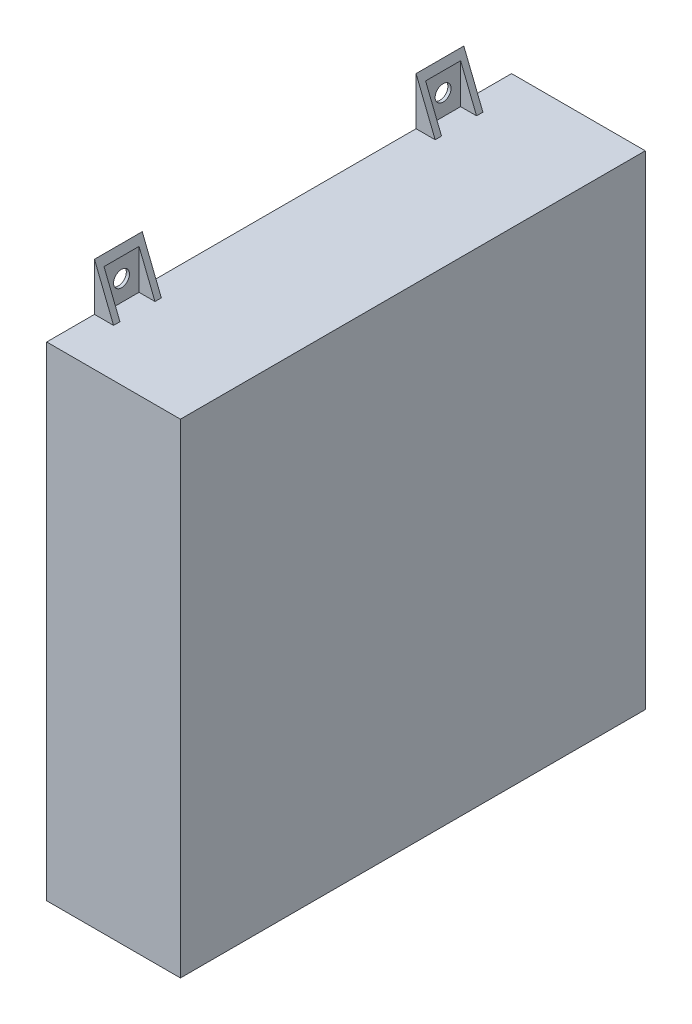
from build123d import *

# Parameters (mm, degrees)
SKETCH_1_W            = 146
SKETCH_1_H            = 152
EXTRUDE_1_DEPTH       = 42
EXTRUDE_2_DEPTH       = 15
MIRROR_2_COPY_1_DEPTH = 15
CUT_EXTRUDE_START     = -2
CUT_EXTRUDE_1_DEPTH   = 11
MIRROR_START          = -2
MIRROR_4_COPY_1_DEPTH = 11
SKETCH_4_R            = 2.5
CUT_EXTRUDE_2_DEPTH   = 11


with BuildPart() as part:
    # 草图1 → 凸台-拉伸1 (new body)
    with BuildSketch(Plane(origin=(0, 0, 0), x_dir=(0, 0, -1), z_dir=(1, 0, 0))):
        Rectangle(SKETCH_1_W, SKETCH_1_H)
    extrude(amount=EXTRUDE_1_DEPTH)

    # 草图2 → 凸台-拉伸2 (add)
    with BuildSketch(Plane.XY.offset(58)):
        Polygon((0, -76), (0, -91), (6, -76), align=None)
    extrude_2 = extrude(amount=-EXTRUDE_2_DEPTH)

    # 镜向1: 凸台-拉伸2 across plane
    add(extrude_2.mirror(Plane(origin=(0, 0, 0), x_dir=(0, 0, 1), z_dir=(0, -1, 0))))

    # 镜向2: 凸台-拉伸2 across plane
    add(extrude_2.mirror(Plane(origin=(0, 0, 0), x_dir=(1, 0, 0), z_dir=(0, 0, -1))))

    # 镜向2 copy 1 sketch → 镜向2 copy 1 (add)
    with BuildSketch(Plane(origin=(0, 0, -58), x_dir=(1, 0, 0), z_dir=(0, 0, -1))):
        Polygon((0, -76), (0, -91), (6, -76), align=None)
    extrude(amount=-MIRROR_2_COPY_1_DEPTH)

    # 草图3 → 切除-拉伸1 (cut)
    with BuildSketch(Plane.XY.offset(58).offset(CUT_EXTRUDE_START)):
        Polygon((6, -76), (1, -88.5), (1, -76), align=None)
    cut_extrude_1 = extrude(amount=-CUT_EXTRUDE_1_DEPTH, mode=Mode.SUBTRACT)

    # 镜向3: 切除-拉伸1 across plane
    add(cut_extrude_1.mirror(Plane(origin=(0, 0, 0), x_dir=(1, 0, 0), z_dir=(0, 0, -1))), mode=Mode.SUBTRACT)

    # 镜向4: 切除-拉伸1 across plane
    add(cut_extrude_1.mirror(Plane(origin=(0, 0, 0), x_dir=(0, 0, 1), z_dir=(0, -1, 0))), mode=Mode.SUBTRACT)

    # 镜向4 copy 1 sketch → 镜向4 copy 1 (cut)
    with BuildSketch(Plane(origin=(0, 0, -58), x_dir=(1, 0, 0), z_dir=(0, 0, -1)).offset(MIRROR_START)):
        Polygon((6, -76), (1, -88.5), (1, -76), align=None)
    extrude(amount=-MIRROR_4_COPY_1_DEPTH, mode=Mode.SUBTRACT)

    # 草图4 → 切除-拉伸2 (cut)
    with BuildSketch(Plane(origin=(1, 0, 0), x_dir=(0, 0, -1), z_dir=(1, 0, 0))):
        with Locations((-50.5, -82.5)):
            Circle(SKETCH_4_R)
        with Locations((50.5, -82.5)):
            Circle(SKETCH_4_R)
        with Locations((-50.5, 82.5)):
            Circle(SKETCH_4_R)
        with Locations((50.5, 82.5)):
            Circle(SKETCH_4_R)
    extrude(amount=-CUT_EXTRUDE_2_DEPTH, mode=Mode.SUBTRACT)


solid = part.part
